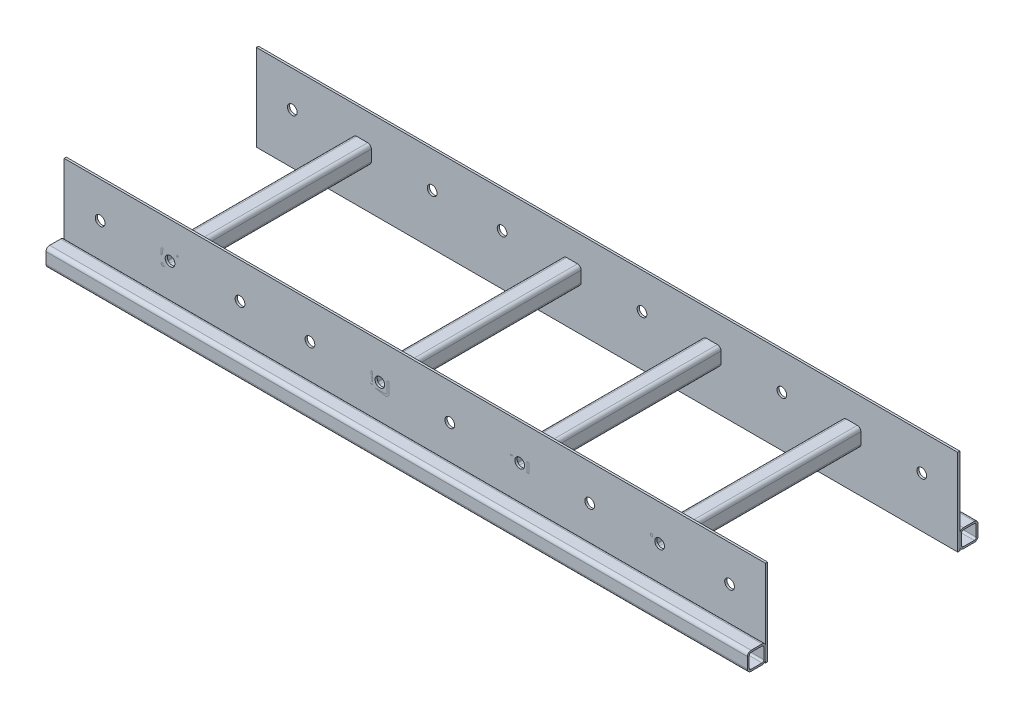
from build123d import *

# Parameters (mm, degrees)
SKETCH1_W                         = 974.6
SKETCH1_H                         = 120
SKETCH1_R                         = 6.75
BOSS_EXTRUDE1_DEPTH               = 3
SKETCH3_W                         = 974.6
SKETCH3_H                         = 120
SKETCH3_R                         = 6.75
BOSS_EXTRUDE2_DEPTH               = 3
TUBE_SQUARE_TS25X25X2_5_1_DEPTH   = 974.6
TUBE_SQUARE_TS25X25X2_5_1_2_DEPTH = 974.6
TUBE_SQUARE_TS25X25X2_5_2_DEPTH   = 270
TUBE_SQUARE_TS25X25X2_5_2_2_DEPTH = 270
TUBE_SQUARE_TS25X25X2_5_2_3_DEPTH = 270
TUBE_SQUARE_TS25X25X2_5_2_4_DEPTH = 270


with BuildPart() as part:
    # Sketch1 → Boss-Extrude1 (new body)
    with BuildSketch(Plane.XY):
        Rectangle(SKETCH1_W, SKETCH1_H)
        with Locations((-437.3, 10)):
            Circle(SKETCH1_R, mode=Mode.SUBTRACT)
        with Locations((-340.122222222, 10)):
            Circle(SKETCH1_R, mode=Mode.SUBTRACT)
        with Locations((-242.944444444, 10)):
            Circle(SKETCH1_R, mode=Mode.SUBTRACT)
        with Locations((-145.766666667, 10)):
            Circle(SKETCH1_R, mode=Mode.SUBTRACT)
        with Locations((-48.588888889, 10)):
            Circle(SKETCH1_R, mode=Mode.SUBTRACT)
        with Locations((48.588888889, 10)):
            Circle(SKETCH1_R, mode=Mode.SUBTRACT)
        with Locations((145.766666667, 10)):
            Circle(SKETCH1_R, mode=Mode.SUBTRACT)
        with Locations((242.944444444, 10)):
            Circle(SKETCH1_R, mode=Mode.SUBTRACT)
        with Locations((340.122222222, 10)):
            Circle(SKETCH1_R, mode=Mode.SUBTRACT)
        with Locations((437.3, 10)):
            Circle(SKETCH1_R, mode=Mode.SUBTRACT)
    extrude(amount=BOSS_EXTRUDE1_DEPTH)


with BuildPart() as body_2:
    # Sketch3 → Boss-Extrude2 (new body)
    with BuildSketch(Plane.XY.offset(270)):
        Rectangle(SKETCH3_W, SKETCH3_H)
        with Locations((437.3, 10)):
            Circle(SKETCH3_R, mode=Mode.SUBTRACT)
        with Locations((340.122222222, 10)):
            Circle(SKETCH3_R, mode=Mode.SUBTRACT)
        with Locations((242.944444444, 10)):
            Circle(SKETCH3_R, mode=Mode.SUBTRACT)
        with Locations((145.766666667, 10)):
            Circle(SKETCH3_R, mode=Mode.SUBTRACT)
        with Locations((48.588888889, 10)):
            Circle(SKETCH3_R, mode=Mode.SUBTRACT)
        with Locations((-48.588888889, 10)):
            Circle(SKETCH3_R, mode=Mode.SUBTRACT)
        with Locations((-145.766666667, 10)):
            Circle(SKETCH3_R, mode=Mode.SUBTRACT)
        with Locations((-242.944444444, 10)):
            Circle(SKETCH3_R, mode=Mode.SUBTRACT)
        with Locations((-340.122222222, 10)):
            Circle(SKETCH3_R, mode=Mode.SUBTRACT)
        with Locations((-437.3, 10)):
            Circle(SKETCH3_R, mode=Mode.SUBTRACT)
    extrude(amount=-BOSS_EXTRUDE2_DEPTH)


with BuildPart() as body_3:
    # Sketch11 → Tube square TS25X25X2.5(1) (new body)
    with BuildSketch(Plane(origin=(-487.3, -47.3, -12.5), x_dir=(0, 0, 1), z_dir=(1, 0, 0))):
        with BuildLine():
            Line((-7.62, -12.7), (7.62, -12.7))
            ThreePointArc((7.62, -12.7), (11.212102448, -11.212102448), (12.7, -7.62))
            Line((12.7, -7.62), (12.7, 7.62))
            ThreePointArc((12.7, 7.62), (11.212102448, 11.212102448), (7.62, 12.7))
            Line((7.62, 12.7), (-7.62, 12.7))
            ThreePointArc((-7.62, 12.7), (-11.212102448, 11.212102448), (-12.7, 7.62))
            Line((-12.7, 7.62), (-12.7, -7.62))
            ThreePointArc((-12.7, -7.62), (-11.212102448, -11.212102448), (-7.62, -12.7))
        make_face()
        with BuildLine():
            Line((-7.62, -10.16), (7.62, -10.16))
            ThreePointArc((7.62, -10.16), (9.416051224, -9.416051224), (10.16, -7.62))
            Line((10.16, -7.62), (10.16, 7.62))
            ThreePointArc((10.16, 7.62), (9.416051224, 9.416051224), (7.62, 10.16))
            Line((7.62, 10.16), (-7.62, 10.16))
            ThreePointArc((-7.62, 10.16), (-9.416051224, 9.416051224), (-10.16, 7.62))
            Line((-10.16, 7.62), (-10.16, -7.62))
            ThreePointArc((-10.16, -7.62), (-9.416051224, -9.416051224), (-7.62, -10.16))
        make_face(mode=Mode.SUBTRACT)
    extrude(amount=TUBE_SQUARE_TS25X25X2_5_1_DEPTH)


with BuildPart() as body_4:
    # Sketch11 on segment 2 (carried to segment 2) → Tube square TS25X25X2.5_1 2 (new body)
    with BuildSketch(Plane(origin=(-487.3, -47.3, 282.5), x_dir=(0, 0, 1), z_dir=(1, 0, 0))):
        with BuildLine():
            Line((-7.62, -12.7), (7.62, -12.7))
            ThreePointArc((7.62, -12.7), (11.212102448, -11.212102448), (12.7, -7.62))
            Line((12.7, -7.62), (12.7, 7.62))
            ThreePointArc((12.7, 7.62), (11.212102448, 11.212102448), (7.62, 12.7))
            Line((7.62, 12.7), (-7.62, 12.7))
            ThreePointArc((-7.62, 12.7), (-11.212102448, 11.212102448), (-12.7, 7.62))
            Line((-12.7, 7.62), (-12.7, -7.62))
            ThreePointArc((-12.7, -7.62), (-11.212102448, -11.212102448), (-7.62, -12.7))
        make_face()
        with BuildLine():
            Line((-7.62, -10.16), (7.62, -10.16))
            ThreePointArc((7.62, -10.16), (9.416051224, -9.416051224), (10.16, -7.62))
            Line((10.16, -7.62), (10.16, 7.62))
            ThreePointArc((10.16, 7.62), (9.416051224, 9.416051224), (7.62, 10.16))
            Line((7.62, 10.16), (-7.62, 10.16))
            ThreePointArc((-7.62, 10.16), (-9.416051224, 9.416051224), (-10.16, 7.62))
            Line((-10.16, 7.62), (-10.16, -7.62))
            ThreePointArc((-10.16, -7.62), (-9.416051224, -9.416051224), (-7.62, -10.16))
        make_face(mode=Mode.SUBTRACT)
    extrude(amount=TUBE_SQUARE_TS25X25X2_5_1_2_DEPTH)


with BuildPart() as body_5:
    # Sketch12 → Tube square TS25X25X2.5(2) (new body)
    with BuildSketch(Plane(origin=(340.122222222, 10, 0), x_dir=(1, 0, 0), z_dir=(0, 0, 1))):
        with BuildLine():
            Line((-7.62, -12.7), (7.62, -12.7))
            ThreePointArc((7.62, -12.7), (11.212102448, -11.212102448), (12.7, -7.62))
            Line((12.7, -7.62), (12.7, 7.62))
            ThreePointArc((12.7, 7.62), (11.212102448, 11.212102448), (7.62, 12.7))
            Line((7.62, 12.7), (-7.62, 12.7))
            ThreePointArc((-7.62, 12.7), (-11.212102448, 11.212102448), (-12.7, 7.62))
            Line((-12.7, 7.62), (-12.7, -7.62))
            ThreePointArc((-12.7, -7.62), (-11.212102448, -11.212102448), (-7.62, -12.7))
        make_face()
        with BuildLine():
            Line((-7.62, -10.16), (7.62, -10.16))
            ThreePointArc((7.62, -10.16), (9.416051224, -9.416051224), (10.16, -7.62))
            Line((10.16, -7.62), (10.16, 7.62))
            ThreePointArc((10.16, 7.62), (9.416051224, 9.416051224), (7.62, 10.16))
            Line((7.62, 10.16), (-7.62, 10.16))
            ThreePointArc((-7.62, 10.16), (-9.416051224, 9.416051224), (-10.16, 7.62))
            Line((-10.16, 7.62), (-10.16, -7.62))
            ThreePointArc((-10.16, -7.62), (-9.416051224, -9.416051224), (-7.62, -10.16))
        make_face(mode=Mode.SUBTRACT)
    extrude(amount=TUBE_SQUARE_TS25X25X2_5_2_DEPTH)


with BuildPart() as body_6:
    # Sketch12 on segment 2 (carried to segment 2) → Tube square TS25X25X2.5_2 2 (new body)
    with BuildSketch(Plane(origin=(-48.588888889, 10, 0), x_dir=(1, 0, 0), z_dir=(0, 0, 1))):
        with BuildLine():
            Line((-7.62, -12.7), (7.62, -12.7))
            ThreePointArc((7.62, -12.7), (11.212102448, -11.212102448), (12.7, -7.62))
            Line((12.7, -7.62), (12.7, 7.62))
            ThreePointArc((12.7, 7.62), (11.212102448, 11.212102448), (7.62, 12.7))
            Line((7.62, 12.7), (-7.62, 12.7))
            ThreePointArc((-7.62, 12.7), (-11.212102448, 11.212102448), (-12.7, 7.62))
            Line((-12.7, 7.62), (-12.7, -7.62))
            ThreePointArc((-12.7, -7.62), (-11.212102448, -11.212102448), (-7.62, -12.7))
        make_face()
        with BuildLine():
            Line((-7.62, -10.16), (7.62, -10.16))
            ThreePointArc((7.62, -10.16), (9.416051224, -9.416051224), (10.16, -7.62))
            Line((10.16, -7.62), (10.16, 7.62))
            ThreePointArc((10.16, 7.62), (9.416051224, 9.416051224), (7.62, 10.16))
            Line((7.62, 10.16), (-7.62, 10.16))
            ThreePointArc((-7.62, 10.16), (-9.416051224, 9.416051224), (-10.16, 7.62))
            Line((-10.16, 7.62), (-10.16, -7.62))
            ThreePointArc((-10.16, -7.62), (-9.416051224, -9.416051224), (-7.62, -10.16))
        make_face(mode=Mode.SUBTRACT)
    extrude(amount=TUBE_SQUARE_TS25X25X2_5_2_2_DEPTH)


with BuildPart() as body_7:
    # Sketch12 on segment 3 (carried to segment 3) → Tube square TS25X25X2.5_2 3 (new body)
    with BuildSketch(Plane(origin=(-340.122222222, 10, 0), x_dir=(1, 0, 0), z_dir=(0, 0, 1))):
        with BuildLine():
            Line((-7.62, -12.7), (7.62, -12.7))
            ThreePointArc((7.62, -12.7), (11.212102448, -11.212102448), (12.7, -7.62))
            Line((12.7, -7.62), (12.7, 7.62))
            ThreePointArc((12.7, 7.62), (11.212102448, 11.212102448), (7.62, 12.7))
            Line((7.62, 12.7), (-7.62, 12.7))
            ThreePointArc((-7.62, 12.7), (-11.212102448, 11.212102448), (-12.7, 7.62))
            Line((-12.7, 7.62), (-12.7, -7.62))
            ThreePointArc((-12.7, -7.62), (-11.212102448, -11.212102448), (-7.62, -12.7))
        make_face()
        with BuildLine():
            Line((-7.62, -10.16), (7.62, -10.16))
            ThreePointArc((7.62, -10.16), (9.416051224, -9.416051224), (10.16, -7.62))
            Line((10.16, -7.62), (10.16, 7.62))
            ThreePointArc((10.16, 7.62), (9.416051224, 9.416051224), (7.62, 10.16))
            Line((7.62, 10.16), (-7.62, 10.16))
            ThreePointArc((-7.62, 10.16), (-9.416051224, 9.416051224), (-10.16, 7.62))
            Line((-10.16, 7.62), (-10.16, -7.62))
            ThreePointArc((-10.16, -7.62), (-9.416051224, -9.416051224), (-7.62, -10.16))
        make_face(mode=Mode.SUBTRACT)
    extrude(amount=TUBE_SQUARE_TS25X25X2_5_2_3_DEPTH)


with BuildPart() as body_8:
    # Sketch12 on segment 4 (carried to segment 4) → Tube square TS25X25X2.5_2 4 (new body)
    with BuildSketch(Plane(origin=(145.766666667, 10, 0), x_dir=(1, 0, 0), z_dir=(0, 0, 1))):
        with BuildLine():
            Line((-7.62, -12.7), (7.62, -12.7))
            ThreePointArc((7.62, -12.7), (11.212102448, -11.212102448), (12.7, -7.62))
            Line((12.7, -7.62), (12.7, 7.62))
            ThreePointArc((12.7, 7.62), (11.212102448, 11.212102448), (7.62, 12.7))
            Line((7.62, 12.7), (-7.62, 12.7))
            ThreePointArc((-7.62, 12.7), (-11.212102448, 11.212102448), (-12.7, 7.62))
            Line((-12.7, 7.62), (-12.7, -7.62))
            ThreePointArc((-12.7, -7.62), (-11.212102448, -11.212102448), (-7.62, -12.7))
        make_face()
        with BuildLine():
            Line((-7.62, -10.16), (7.62, -10.16))
            ThreePointArc((7.62, -10.16), (9.416051224, -9.416051224), (10.16, -7.62))
            Line((10.16, -7.62), (10.16, 7.62))
            ThreePointArc((10.16, 7.62), (9.416051224, 9.416051224), (7.62, 10.16))
            Line((7.62, 10.16), (-7.62, 10.16))
            ThreePointArc((-7.62, 10.16), (-9.416051224, 9.416051224), (-10.16, 7.62))
            Line((-10.16, 7.62), (-10.16, -7.62))
            ThreePointArc((-10.16, -7.62), (-9.416051224, -9.416051224), (-7.62, -10.16))
        make_face(mode=Mode.SUBTRACT)
    extrude(amount=TUBE_SQUARE_TS25X25X2_5_2_4_DEPTH)


solid = Compound([part.part, body_2.part, body_3.part, body_4.part, body_5.part, body_6.part, body_7.part, body_8.part])
